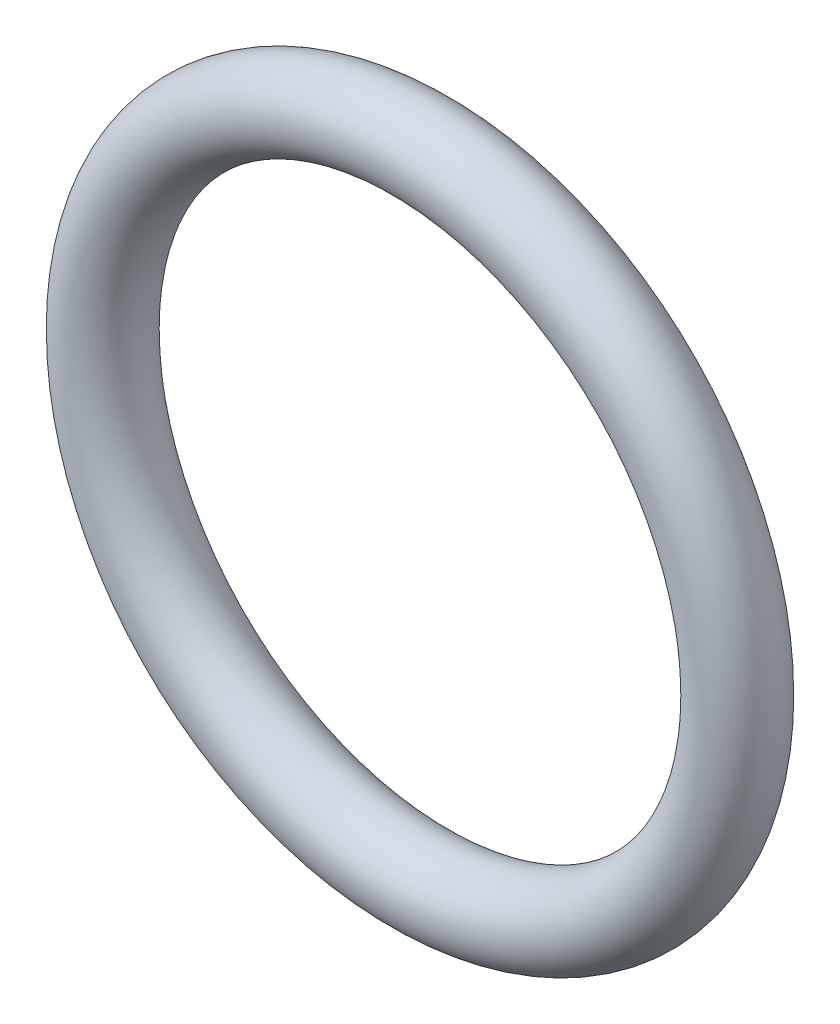
from build123d import *

# Parameters (mm, degrees)
SKETCH2_R = 0.9


with BuildPart() as part:
    # Sweep1: sweep along a path in Sketch1
    with BuildLine(Plane.XY) as sweep1_path:
        CenterArc((0, 0), 6.25, 0, 360)
    # Sketch2 → Sweep1 (sweep)
    with BuildSketch(Plane(origin=(0, 0, 0), x_dir=(1, 0, 0), z_dir=(0, 1, 0))):
        with Locations((-7.15, 0)):
            Circle(SKETCH2_R)
    sweep(path=sweep1_path.line)


solid = part.part
